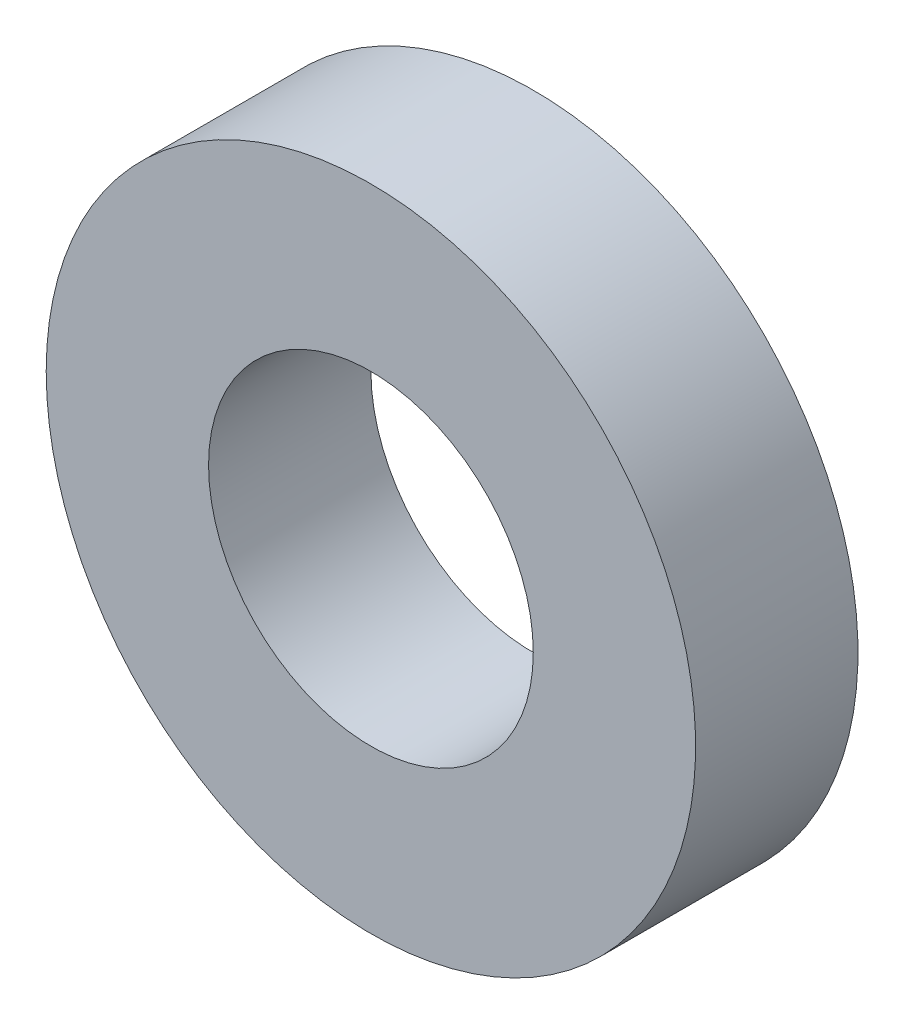
from build123d import *

# Parameters (mm, degrees)
SKETCH1_R           = 10
SKETCH1_R_2         = 5
BOSS_EXTRUDE2_DEPTH = 5


with BuildPart() as part:
    # Sketch1 → Boss-Extrude2 (new body)
    with BuildSketch(Plane.XY):
        with Locations(Location((0, 0, 0), (0, 0, 180))):
            Circle(SKETCH1_R)
        with Locations(Location((0, 0, 0), (0, 0, 180))):
            Circle(SKETCH1_R_2, mode=Mode.SUBTRACT)
    extrude(amount=BOSS_EXTRUDE2_DEPTH)


solid = part.part
